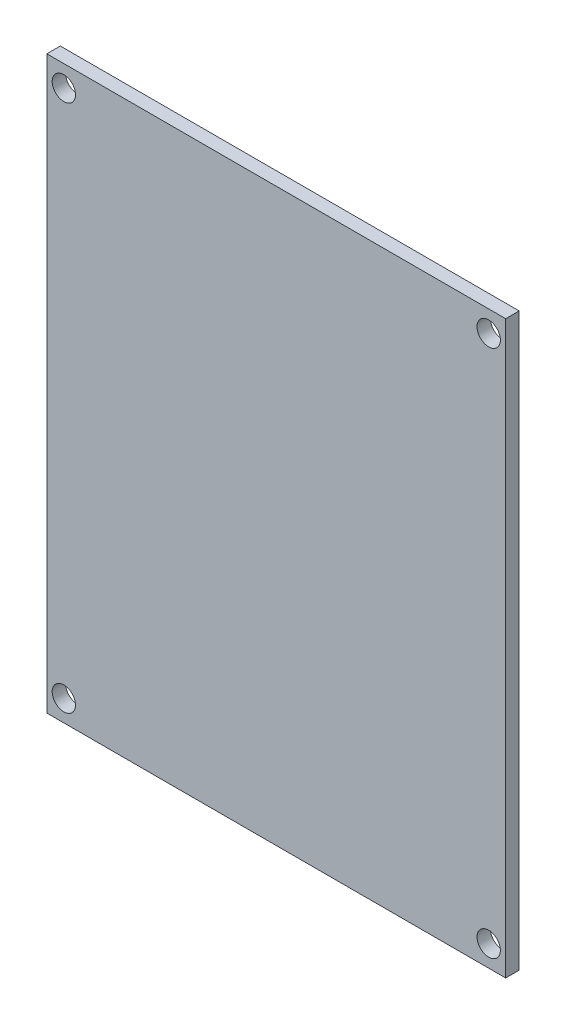
from build123d import *

# Parameters (mm, degrees)
SKETCH1_W           = 120
SKETCH1_H           = 134.5
BOSS_EXTRUDE1_DEPTH = 3.175
CUT_EXTRUDE1_REACH  = 92.181
SKETCH2_W           = 11.91979388
SKETCH2_H           = 134.5
SKETCH2_R           = 2.75


with BuildPart() as part:
    # Sketch1 → Boss-Extrude1 (new body)
    with BuildSketch(Plane.XY):
        Rectangle(SKETCH1_W, SKETCH1_H)
    extrude(amount=BOSS_EXTRUDE1_DEPTH)

    # Sketch2 → Cut-Extrude1 (cut, up to next)
    with BuildSketch(Plane.XY.offset(3.175), mode=Mode.PRIVATE) as cut_extrude1_sk1:
        with Locations((-54.04010306, 0)):
            Rectangle(SKETCH2_W, SKETCH2_H)
    cut_extrude1_tool1 = extrude(cut_extrude1_sk1.sketch, amount=-CUT_EXTRUDE1_REACH, mode=Mode.PRIVATE) & part.part
    # Sketch2 → Cut-Extrude1 (cut, up to next)
    with BuildSketch(Plane.XY.offset(3.175), mode=Mode.PRIVATE) as cut_extrude1_sk2:
        with Locations((-44.08020612, 62.25)):
            Circle(SKETCH2_R)
    cut_extrude1_tool2 = extrude(cut_extrude1_sk2.sketch, amount=-CUT_EXTRUDE1_REACH, mode=Mode.PRIVATE) & part.part
    # Sketch2 → Cut-Extrude1 (cut, up to next)
    with BuildSketch(Plane.XY.offset(3.175), mode=Mode.PRIVATE) as cut_extrude1_sk3:
        with Locations((56, -62.25)):
            Circle(SKETCH2_R)
    cut_extrude1_tool3 = extrude(cut_extrude1_sk3.sketch, amount=-CUT_EXTRUDE1_REACH, mode=Mode.PRIVATE) & part.part
    # Sketch2 → Cut-Extrude1 (cut, up to next)
    with BuildSketch(Plane.XY.offset(3.175), mode=Mode.PRIVATE) as cut_extrude1_sk4:
        with Locations((-44.08020612, -62.25)):
            Circle(SKETCH2_R)
    cut_extrude1_tool4 = extrude(cut_extrude1_sk4.sketch, amount=-CUT_EXTRUDE1_REACH, mode=Mode.PRIVATE) & part.part
    # Sketch2 → Cut-Extrude1 (cut, up to next)
    with BuildSketch(Plane.XY.offset(3.175), mode=Mode.PRIVATE) as cut_extrude1_sk5:
        with Locations((56, 62.25)):
            Circle(SKETCH2_R)
    cut_extrude1_tool5 = extrude(cut_extrude1_sk5.sketch, amount=-CUT_EXTRUDE1_REACH, mode=Mode.PRIVATE) & part.part
    add(cut_extrude1_tool1.solids().sort_by_distance((-54.040103, 0, 3.175))[0], mode=Mode.SUBTRACT)
    add(cut_extrude1_tool2.solids().sort_by_distance((-44.080206, 62.25, 3.175))[0], mode=Mode.SUBTRACT)
    add(cut_extrude1_tool3.solids().sort_by_distance((56, -62.25, 3.175))[0], mode=Mode.SUBTRACT)
    add(cut_extrude1_tool4.solids().sort_by_distance((-44.080206, -62.25, 3.175))[0], mode=Mode.SUBTRACT)
    add(cut_extrude1_tool5.solids().sort_by_distance((56, 62.25, 3.175))[0], mode=Mode.SUBTRACT)


solid = part.part
